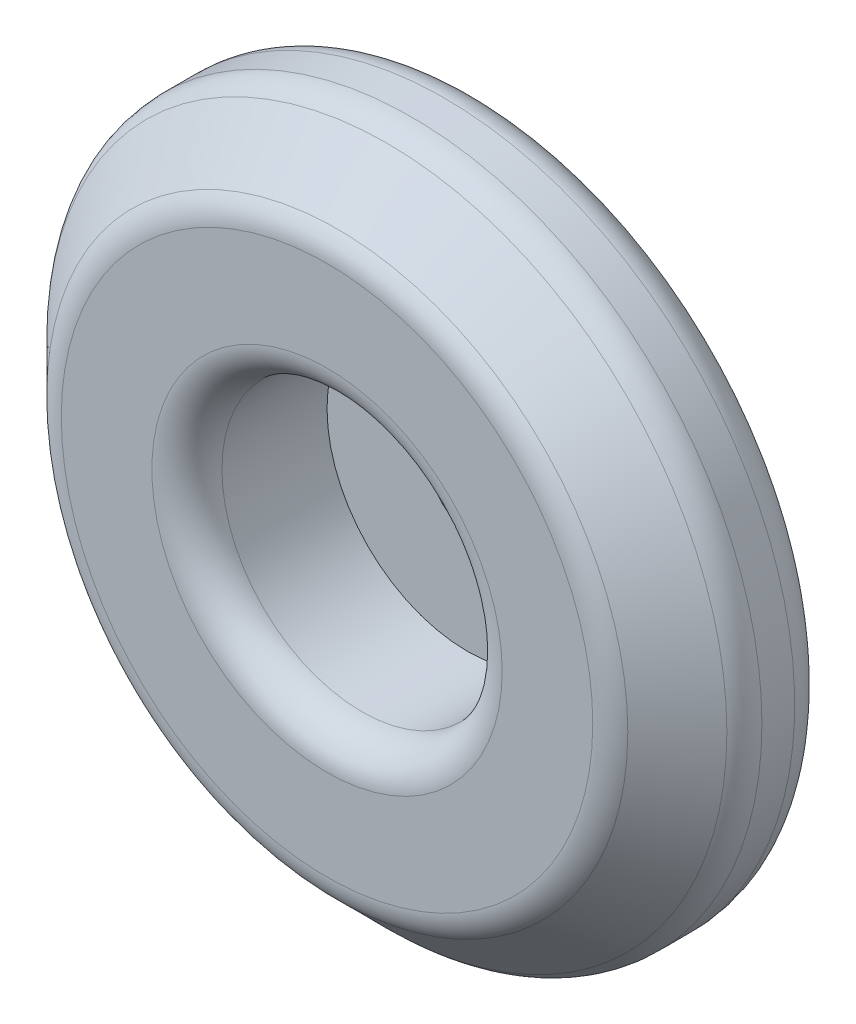
from build123d import *

# Parameters (mm, degrees)
SKETCH1_R           = 63.5
BOSS_EXTRUDE1_DEPTH = 50.8
SKETCH2_R           = 25.4
CUT_EXTRUDE2_DEPTH  = 25.4
SKETCH3_R           = 6.35
CUT_EXTRUDE3_DEPTH  = 94.3255592
SKETCH6_R           = 12.7
CUT_EXTRUDE4_DEPTH  = 6.35
CHAMFER1_SIZE       = 12.7
FILLET1_R           = 6.35


with BuildPart() as part:
    # Sketch1 → Boss-Extrude1 (new body)
    with BuildSketch(Plane.XY):
        Circle(SKETCH1_R)
    extrude(amount=BOSS_EXTRUDE1_DEPTH)

    # Sketch2 → Cut-Extrude2 (cut)
    with BuildSketch(Plane.XY.offset(50.8)):
        Circle(SKETCH2_R)
    extrude(amount=-CUT_EXTRUDE2_DEPTH, mode=Mode.SUBTRACT)

    # Sketch3 → Cut-Extrude3 (cut, through all)
    with BuildSketch(Plane.XY.offset(25.4)):
        Circle(SKETCH3_R)
    extrude(amount=-CUT_EXTRUDE3_DEPTH, mode=Mode.SUBTRACT)

    # Sketch4 → Cut-Revolve1 (revolve, cut)
    with BuildSketch(Plane(origin=(0, 0, 0), x_dir=(0, 0, -1), z_dir=(1, 0, 0)), mode=Mode.PRIVATE) as cut_revolve1_sk:
        Polygon((0, 63.5), (-25.4, 63.5), (0, 6.35), align=None)
    revolve(cut_revolve1_sk.sketch.rotate(Axis((0, 0, 0), (0, 0, -1)), 90), axis=Axis((0, 0, 0), (0, 0, -1)), mode=Mode.SUBTRACT)

    # Sketch6 → Cut-Extrude4 (cut)
    with BuildSketch(Plane.XY):
        Circle(SKETCH6_R)
    extrude(amount=CUT_EXTRUDE4_DEPTH, mode=Mode.SUBTRACT)

    # Chamfer1
    chamfer1_edges = [part.edges().sort_by_distance(p)[0] for p in [
        (-63.5, 0, 50.8),
    ]]
    chamfer(chamfer1_edges, length=CHAMFER1_SIZE)

    # Fillet1
    fillet1_edges = [part.edges().sort_by_distance(p)[0] for p in [
        (-63.5, 0, 25.4),
        (-50.8, 0, 50.8),
        (-63.5, 0, 38.1),
        (-25.4, 0, 50.8),
    ]]
    fillet(fillet1_edges, radius=FILLET1_R)


solid = part.part
